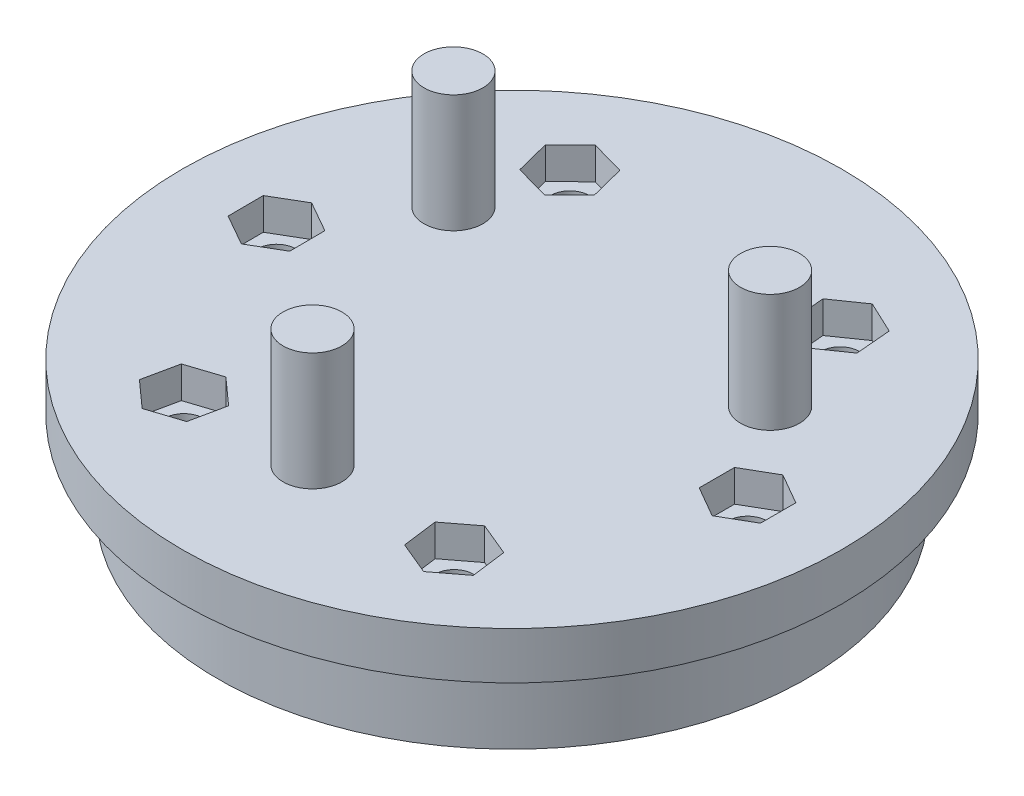
from build123d import *

# Parameters (mm, degrees)
SKETCH3_R               = 28
BOSS_EXTRUDE1_DEPTH     = 4
SKETCH6_R               = 25
BOSS_EXTRUDE4_DEPTH     = 7
SKETCH7_R               = 2.5
BOSS_EXTRUDE5_DEPTH     = 10
CUT_EXTRUDE1_DEPTH      = 10
CUT_EXTRUDE1_DEPTH_BACK = 43
SKETCH8_R               = 1.65
CUT_EXTRUDE3_DEPTH      = 2.7


with BuildPart() as part:
    # Sketch3 → Boss-Extrude1 (new body)
    with BuildSketch(Plane(origin=(0, 0, 0), x_dir=(1, 0, 0), z_dir=(0, 1, 0))):
        with Locations(Location((0, 0, 0), (0, 0, 270))):
            Circle(SKETCH3_R)
    extrude(amount=BOSS_EXTRUDE1_DEPTH)

    # Sketch6 → Boss-Extrude4 (add)
    with BuildSketch(Plane.XZ):
        with Locations(Location((0, 0, 0), (0, 0, 270))):
            Circle(SKETCH6_R)
    extrude(amount=BOSS_EXTRUDE4_DEPTH)

    # Sketch7 → Boss-Extrude5 (add)
    with BuildSketch(Plane(origin=(0, 4, 0), x_dir=(1, 0, 0), z_dir=(0, 1, 0))):
        with Locations(Location((14.413926039, 7.503414965, 0), (0, 0, 270))):
            Circle(SKETCH7_R)
        with Locations(Location((-13.705110994, 8.731118636, 0), (0, 0, 270))):
            Circle(SKETCH7_R)
        with Locations(Location((-0.708815045, -16.234533601, 0), (0, 0, 270))):
            Circle(SKETCH7_R)
    extrude(amount=BOSS_EXTRUDE5_DEPTH)

    # Sketch8 → Cut-Extrude1 (cut, two sides: drawn at the far end of the back side and taken through both)
    with BuildSketch(Plane.XZ.offset(-CUT_EXTRUDE1_DEPTH_BACK)):
        with Locations(Location((20, 0, 0), (0, 0, 90))):
            Circle(SKETCH8_R)
        with Locations(Location((-20, 0, 0), (0, 0, 90))):
            Circle(SKETCH8_R)
        with Locations(Location((11.471528727, 16.383040886, 0), (0, 0, 90))):
            Circle(SKETCH8_R)
        with Locations(Location((-11.471528727, -16.383040886, 0), (0, 0, 90))):
            Circle(SKETCH8_R)
        with Locations(Location((11.471528727, -16.383040886, 0), (0, 0, 90))):
            Circle(SKETCH8_R)
        with Locations(Location((-11.471528727, 16.383040886, 0), (0, 0, 90))):
            Circle(SKETCH8_R)
    extrude(amount=CUT_EXTRUDE1_DEPTH + CUT_EXTRUDE1_DEPTH_BACK, mode=Mode.SUBTRACT)

    # Sketch11 → Cut-Extrude3 (cut)
    with BuildSketch(Plane(origin=(0, 4, 0), x_dir=(1, 0, 0), z_dir=(0, 1, 0))):
        Polygon((11.858091258, -19.360271603), (14.243167426, -17.536883273), (13.856604896, -14.559652555), (11.084966196, -13.405810169), (8.699890028, -15.229198499), (9.086452558, -18.206429216), align=None)
        Polygon((-12.091418901, -19.320568674), (-9.237500125, -18.388645418), (-8.617609951, -15.45111763), (-10.851638553, -13.445513098), (-13.705557329, -14.377436353), (-14.325447503, -17.314964141), align=None)
        Polygon((-22.590586111, -1.517299224), (-19.981273382, -3.002162995), (-17.390687271, -1.48486377), (-17.409413889, 1.517299224), (-20.018726618, 3.002162995), (-22.609312729, 1.48486377), align=None)
        Polygon((20, -3.0022214), (22.6, -1.5011107), (22.6, 1.5011107), (20, 3.0022214), (17.4, 1.5011107), (17.4, -1.5011107), align=None)
        Polygon((9.008253879, 14.666762832), (11.726231698, 13.391643264), (14.189506546, 15.107921318), (13.934803575, 18.09931894), (11.216825756, 19.374438507), (8.753550908, 17.658160453), align=None)
        Polygon((-10.729703857, 13.473912288), (-8.581237024, 15.57091577), (-9.323061894, 18.480044367), (-12.213353597, 19.292169483), (-14.36182043, 17.195166002), (-13.61999556, 14.286037405), align=None)
    extrude(amount=-CUT_EXTRUDE3_DEPTH, mode=Mode.SUBTRACT)


solid = part.part
